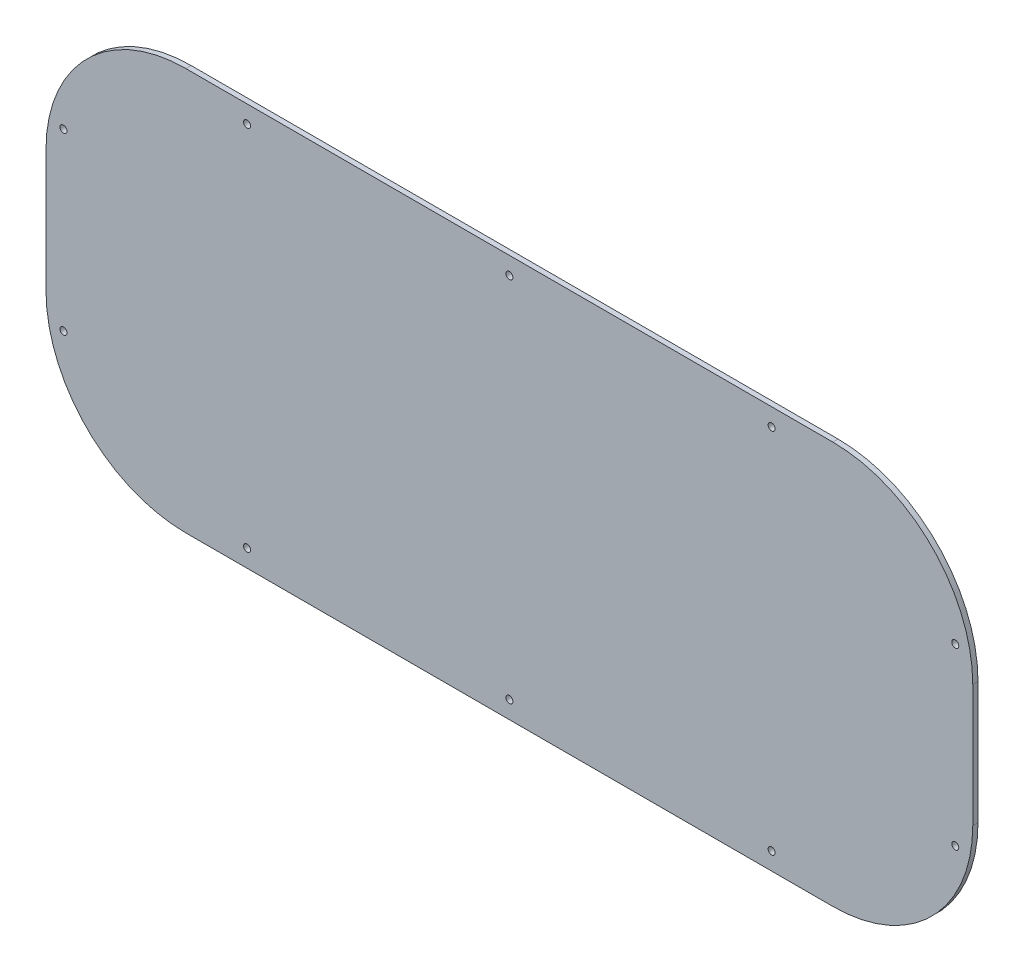
from build123d import *

# Parameters (mm, degrees)
SKETCH_1_W          = 530
SKETCH_1_H          = 230
EXTRUDE_1_DEPTH     = 3
FILLET_1_R          = 80
SKETCH_2_R          = 2
CUT_EXTRUDE_1_DEPTH = 10


with BuildPart() as part:
    # 草图1 → 凸台-拉伸1 (new body)
    with BuildSketch(Plane.XY):
        Rectangle(SKETCH_1_W, SKETCH_1_H)
    extrude(amount=EXTRUDE_1_DEPTH)

    # 圆角1
    fillet_1_edges = [part.edges().sort_by_distance(p)[0] for p in [
        (265, -115, 1.5),
        (-265, -115, 1.5),
        (-265, 115, 1.5),
        (265, 115, 1.5),
    ]]
    fillet(fillet_1_edges, radius=FILLET_1_R)

    # 草图2 → 切除-拉伸1 (cut)
    with BuildSketch(Plane.XY.offset(3)):
        with Locations((-255, -50)):
            Circle(SKETCH_2_R)
        with Locations((-255, 50)):
            Circle(SKETCH_2_R)
        with Locations((-150, -105)):
            Circle(SKETCH_2_R)
        with Locations((0, -105)):
            Circle(SKETCH_2_R)
        with Locations((150, -105)):
            Circle(SKETCH_2_R)
        with Locations((255, -50)):
            Circle(SKETCH_2_R)
        with Locations((255, 50)):
            Circle(SKETCH_2_R)
        with Locations((150, 105)):
            Circle(SKETCH_2_R)
        with Locations((0, 105)):
            Circle(SKETCH_2_R)
        with Locations((-150, 105)):
            Circle(SKETCH_2_R)
    extrude(amount=-CUT_EXTRUDE_1_DEPTH, mode=Mode.SUBTRACT)


solid = part.part
